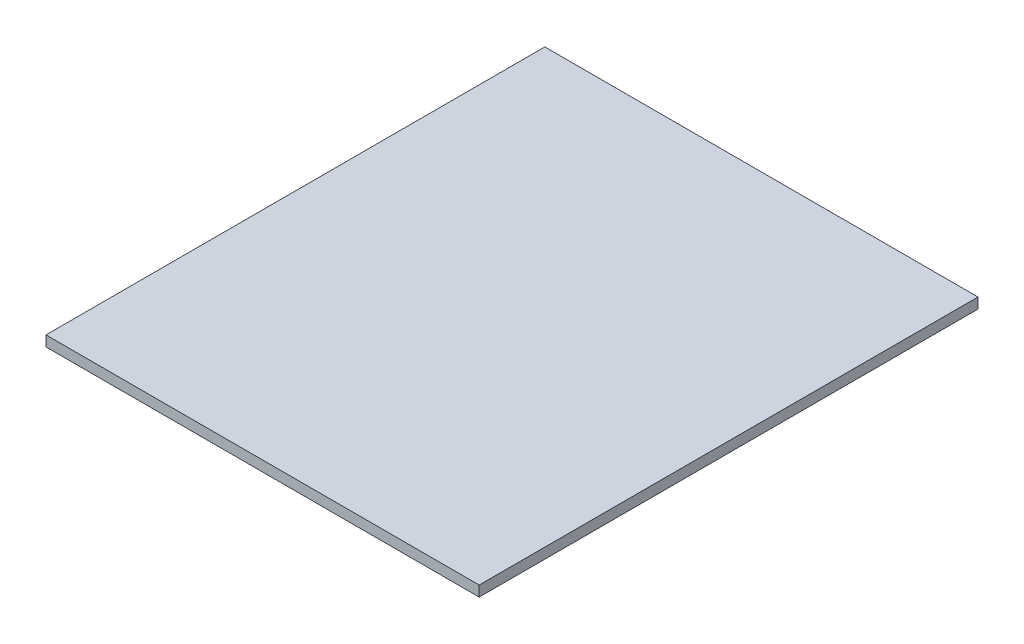
from build123d import *

# Parameters (mm, degrees)
SKETCH1_W           = 1676.4
SKETCH1_H           = 1930.4
BOSS_EXTRUDE1_DEPTH = 40.48125


with BuildPart() as part:
    # Sketch1 → Boss-Extrude1 (new body)
    with BuildSketch(Plane(origin=(0, 0, 0), x_dir=(1, 0, 0), z_dir=(0, 1, 0))):
        with Locations((-21.475895885, 0.122022136)):
            Rectangle(SKETCH1_W, SKETCH1_H)
    extrude(amount=BOSS_EXTRUDE1_DEPTH)


solid = part.part
